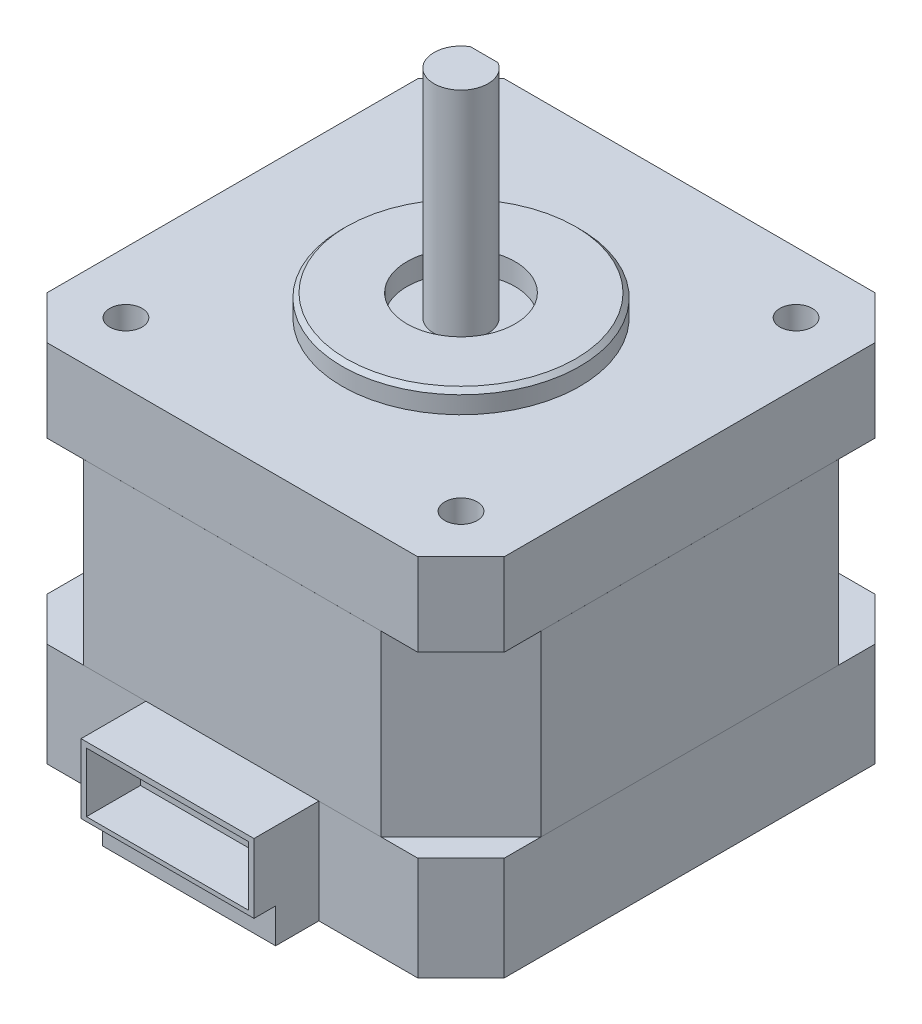
from build123d import *

# Parameters (mm, degrees)
EXTRUDE1_START       = -17
SKETCH1_W            = 42.3
SKETCH1_H            = 42.3
EXTRUDE1_DEPTH       = 9.6
CHAMFER3_SIZE        = 4
BOSS_EXTRUDE8_DEPTH  = 16.5
BOSS_EXTRUDE9_DEPTH  = 7.65
SKETCH33_R           = 11
BOSS_EXTRUDE10_DEPTH = 2
SKETCH34_R           = 5
CUT_EXTRUDE1_DEPTH   = 2
SKETCH35_R           = 2.5
BOSS_EXTRUDE11_DEPTH = 20
CUT_EXTRUDE3_START   = -15
CUT_EXTRUDE3_DEPTH   = 15
SKETCH37_W           = 27.5
SKETCH37_H           = 16.5
BOSS_EXTRUDE12_DEPTH = 0.001
SKETCH38_W           = 27.5
SKETCH38_H           = 16.5
BOSS_EXTRUDE13_DEPTH = 0.001
SKETCH39_W           = 27.5
SKETCH39_H           = 16.5
BOSS_EXTRUDE14_DEPTH = 0.001
SKETCH40_W           = 27.5
SKETCH40_H           = 16.5
BOSS_EXTRUDE15_DEPTH = 0.001
SKETCH41_R           = 1.5
CUT_EXTRUDE4_DEPTH   = 6
CUT_EXTRUDE5_START   = -3
SKETCH42_R           = 4.5
SKETCH42_R_2         = 1.5
CUT_EXTRUDE5_DEPTH   = 3
SKETCH43_W           = 16
SKETCH43_H           = 4
BOSS_EXTRUDE16_DEPTH = 3.2
SKETCH44_W           = 16
SKETCH44_H           = 6.4
BOSS_EXTRUDE17_DEPTH = 6
SKETCH45_W           = 15
SKETCH45_H           = 5.5
CUT_EXTRUDE6_DEPTH   = 5
BOSS_EXTRUDE18_START = 1.5
SKETCH46_R           = 1.5
BOSS_EXTRUDE18_DEPTH = 1.5
CHAMFER4_SIZE        = 0.4


with BuildPart() as part:
    # Sketch1 → Extrude1 (new body)
    with BuildSketch(Plane(origin=(0, 0, 0), x_dir=(1, 0, 0), z_dir=(0, 1, 0)).offset(EXTRUDE1_START)):
        Rectangle(SKETCH1_W, SKETCH1_H)
    extrude(amount=EXTRUDE1_DEPTH)

    # Chamfer3
    chamfer3_edges = [part.edges().sort_by_distance(p)[0] for p in [
        (-21.15, -12.2, -21.15),
        (21.15, -12.2, -21.15),
        (21.15, -12.2, 21.15),
        (-21.15, -12.2, 21.15),
    ]]
    chamfer(chamfer3_edges, length=CHAMFER3_SIZE)

    # Sketch31 → Boss-Extrude8 (add)
    with BuildSketch(Plane(origin=(0, -7.4, 0), x_dir=(1, 0, 0), z_dir=(0, 1, 0))):
        Polygon((-13.75, 21.15), (13.75, 21.15), (21.15, 13.75), (21.15, -13.75), (13.75, -21.15), (-13.75, -21.15), (-21.15, -13.75), (-21.15, 13.75), align=None)
    extrude(amount=BOSS_EXTRUDE8_DEPTH)

    # Sketch32 → Boss-Extrude9 (add)
    with BuildSketch(Plane(origin=(0, 9.1, 0), x_dir=(1, 0, 0), z_dir=(0, 1, 0))):
        Polygon((-17.15, 21.15), (-21.15, 17.15), (-21.15, 13.75), (-21.15, -13.75), (-21.15, -17.15), (-17.15, -21.15), (-13.75, -21.15), (13.75, -21.15), (17.15, -21.15), (21.15, -17.15), (21.15, -13.75), (21.15, 13.75), (21.15, 17.15), (17.15, 21.15), (13.75, 21.15), (-13.75, 21.15), align=None)
    extrude(amount=BOSS_EXTRUDE9_DEPTH)

    # Sketch33 → Boss-Extrude10 (add)
    with BuildSketch(Plane(origin=(0, 16.75, 0), x_dir=(1, 0, 0), z_dir=(0, 1, 0))):
        with Locations(Location((0, 0, 0), (0, 0, 270))):
            Circle(SKETCH33_R)
    extrude(amount=BOSS_EXTRUDE10_DEPTH)

    # Sketch34 → Cut-Extrude1 (cut)
    with BuildSketch(Plane(origin=(0, 18.75, 0), x_dir=(1, 0, 0), z_dir=(0, 1, 0))):
        with Locations(Location((0, 0, 0), (0, 0, 270))):
            Circle(SKETCH34_R)
    extrude(amount=-CUT_EXTRUDE1_DEPTH, mode=Mode.SUBTRACT)

    # Sketch35 → Boss-Extrude11 (add)
    with BuildSketch(Plane(origin=(0, 16.75, 0), x_dir=(1, 0, 0), z_dir=(0, 1, 0))):
        with Locations(Location((0, 0, 0), (0, 0, 270))):
            Circle(SKETCH35_R)
    extrude(amount=BOSS_EXTRUDE11_DEPTH)

    # Sketch36 → Cut-Extrude3 (cut)
    with BuildSketch(Plane(origin=(0, 36.75, 0), x_dir=(1, 0, 0), z_dir=(0, 1, 0)).offset(CUT_EXTRUDE3_START)):
        with BuildLine():
            Line((-1.275735082, 2.15), (0, 2.15))
            Line((0, 2.15), (1.275735082, 2.15))
            ThreePointArc((1.275735082, 2.15), (0, 2.5), (-1.275735082, 2.15))
        make_face()
    extrude(amount=CUT_EXTRUDE3_DEPTH, mode=Mode.SUBTRACT)

    # Sketch37 → Boss-Extrude12 (add)
    with BuildSketch(Plane(origin=(21.15, 0, 0), x_dir=(0, 0, -1), z_dir=(1, 0, 0))):
        with Locations((0, 0.85)):
            Rectangle(SKETCH37_W, SKETCH37_H)
    extrude(amount=BOSS_EXTRUDE12_DEPTH)

    # Sketch38 → Boss-Extrude13 (add)
    with BuildSketch(Plane.XY.offset(21.15)):
        with Locations((0, 0.85)):
            Rectangle(SKETCH38_W, SKETCH38_H)
    extrude(amount=BOSS_EXTRUDE13_DEPTH)

    # Sketch39 → Boss-Extrude14 (add)
    with BuildSketch(Plane.ZY.offset(21.15)):
        with Locations((0, 0.85)):
            Rectangle(SKETCH39_W, SKETCH39_H)
    extrude(amount=BOSS_EXTRUDE14_DEPTH)

    # Sketch40 → Boss-Extrude15 (add)
    with BuildSketch(Plane(origin=(0, 0, -21.15), x_dir=(-1, 0, 0), z_dir=(0, 0, -1))):
        with Locations((0, 0.85)):
            Rectangle(SKETCH40_W, SKETCH40_H)
    extrude(amount=BOSS_EXTRUDE15_DEPTH)

    # Sketch41 → Cut-Extrude4 (cut)
    with BuildSketch(Plane(origin=(0, 16.75, 0), x_dir=(1, 0, 0), z_dir=(0, 1, 0))):
        with Locations(Location((-15.5, 15.5, 0), (0, 0, 270))):
            Circle(SKETCH41_R)
        with Locations(Location((-15.5, -15.5, 0), (0, 0, 90))):
            Circle(SKETCH41_R)
        with Locations(Location((15.5, -15.5, 0), (0, 0, 270))):
            Circle(SKETCH41_R)
        with Locations(Location((15.5, 15.5, 0), (0, 0, 90))):
            Circle(SKETCH41_R)
    extrude(amount=-CUT_EXTRUDE4_DEPTH, mode=Mode.SUBTRACT)

    # Sketch42 → Cut-Extrude5 (cut)
    with BuildSketch(Plane.XZ.offset(17).offset(CUT_EXTRUDE5_START)):
        with Locations(Location((0, 0, 0), (0, 0, 270))):
            Circle(SKETCH42_R)
        with Locations(Location((-15.5, 15.5, 0), (0, 0, 270))):
            Circle(SKETCH42_R_2)
        with Locations(Location((15.5, 15.5, 0), (0, 0, 90))):
            Circle(SKETCH42_R_2)
        with Locations(Location((15.5, -15.5, 0), (0, 0, 270))):
            Circle(SKETCH42_R_2)
        with Locations(Location((-15.5, -15.5, 0), (0, 0, 90))):
            Circle(SKETCH42_R_2)
    extrude(amount=CUT_EXTRUDE5_DEPTH, mode=Mode.SUBTRACT)

    # Sketch43 → Boss-Extrude16 (add)
    with BuildSketch(Plane.XZ.offset(17)):
        with Locations((0, 23.15)):
            Rectangle(SKETCH43_W, SKETCH43_H)
    extrude(amount=-BOSS_EXTRUDE16_DEPTH)

    # Sketch44 → Boss-Extrude17 (add)
    with BuildSketch(Plane.XY.offset(21.15)):
        with Locations((0, -10.6)):
            Rectangle(SKETCH44_W, SKETCH44_H)
    extrude(amount=BOSS_EXTRUDE17_DEPTH)

    # Sketch45 → Cut-Extrude6 (cut)
    with BuildSketch(Plane.XY.offset(27.15)):
        with Locations((0, -10.65)):
            Rectangle(SKETCH45_W, SKETCH45_H)
    extrude(amount=-CUT_EXTRUDE6_DEPTH, mode=Mode.SUBTRACT)

    # Sketch46 → Boss-Extrude18 (add)
    with BuildSketch(Plane(origin=(0, 10.75, 0), x_dir=(1, 0, 0), z_dir=(0, 1, 0)).offset(BOSS_EXTRUDE18_START)):
        with Locations(Location((-15.5, -15.5, 0), (0, 0, 270))):
            Circle(SKETCH46_R)
        with Locations(Location((-15.5, 15.5, 0), (0, 0, 270))):
            Circle(SKETCH46_R)
        with Locations(Location((15.5, 15.5, 0), (0, 0, 270))):
            Circle(SKETCH46_R)
        with Locations(Location((15.5, -15.5, 0), (0, 0, 270))):
            Circle(SKETCH46_R)
    extrude(amount=-BOSS_EXTRUDE18_DEPTH)

    # Chamfer4
    chamfer4_edges = [part.edges().sort_by_distance(p)[0] for p in [
        (0, 18.75, -11),
    ]]
    chamfer(chamfer4_edges, length=CHAMFER4_SIZE)


solid = part.part
